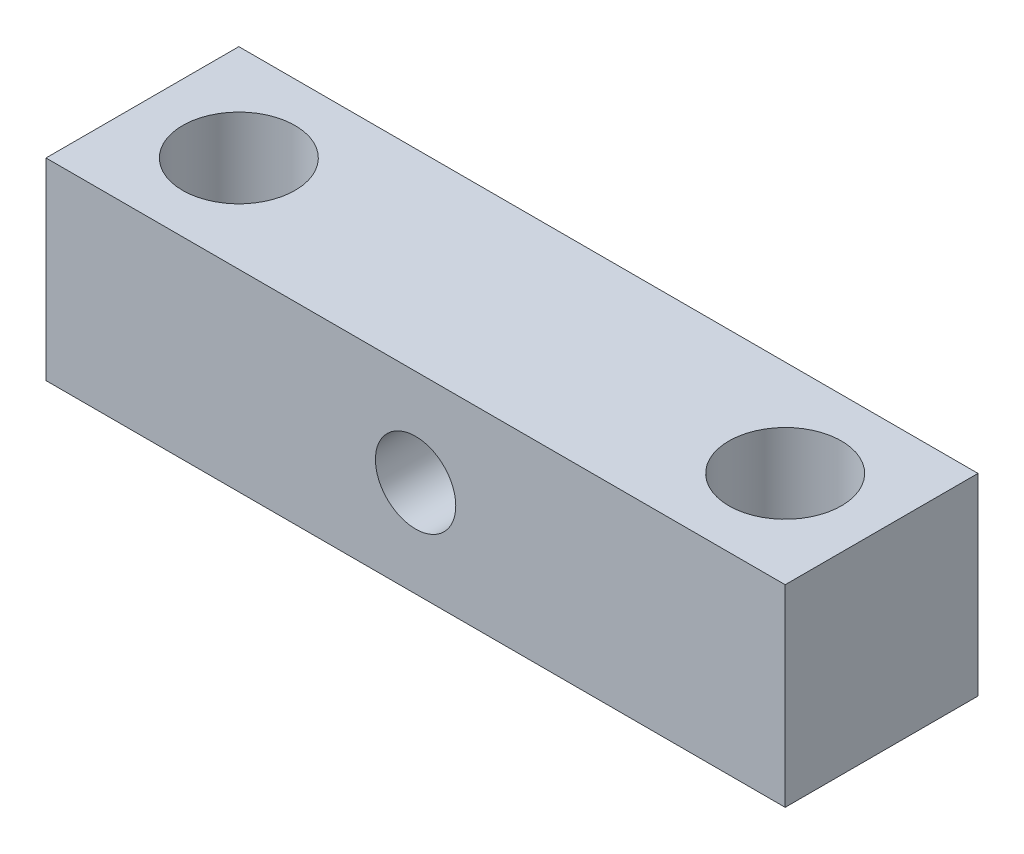
from build123d import *

# Parameters (mm, degrees)
SKETCH1_W                = 46
SKETCH1_H                = 12
BOSS_EXTRUDE1_DEPTH      = 12
F_7_0_7_DIAMETER_HOLE1_D = 7
M6X1_0_TAPPED_HOLE1_D    = 5


with BuildPart() as part:
    # Sketch1 → Boss-Extrude1 (new body)
    with BuildSketch(Plane(origin=(0, 0, 0), x_dir=(1, 0, 0), z_dir=(0, 1, 0))):
        with Locations((0, 6)):
            Rectangle(SKETCH1_W, SKETCH1_H)
    extrude(amount=BOSS_EXTRUDE1_DEPTH)

    # Ø7.0 (7) Diameter Hole1 (through all)
    with Locations(Plane(origin=(-8.628001273, 12, -9.044925154), x_dir=(1, 0, 0), z_dir=(0, 1, 0))):
        with Locations((25.628001273, -3.044925154), (-8.371998727, -3.044925154)):
            Hole(F_7_0_7_DIAMETER_HOLE1_D / 2)

    # M6x1.0 Tapped Hole1 (through all)
    with Locations(Plane.XY):
        with Locations((0, 6)):
            Hole(M6X1_0_TAPPED_HOLE1_D / 2)


solid = part.part
